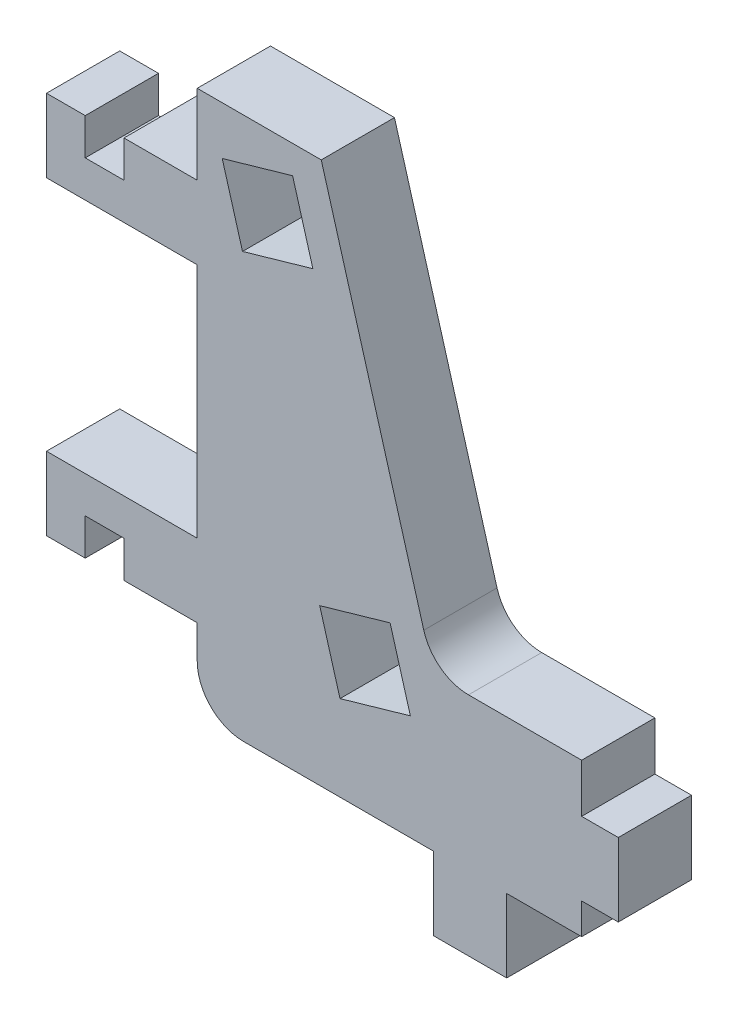
from build123d import *

# Parameters (mm, degrees)
BOSS_EXTRUDE1_DEPTH = 6
FILLET1_R           = 3.81
CUT_EXTRUDE1_DEPTH  = 57.584242648


with BuildPart() as part:
    # Sketch1 → Boss-Extrude1 (new body)
    with BuildSketch(Plane.XY):
        Polygon((-12.35, 31.925), (0, 31.925), (0, 37.925), (-6, 37.925), (-6, 34.925), (-9.175, 34.925), (-9.175, 37.925), (-12.35, 37.925), align=None)
        Polygon((19.3548, 12.525), (31.496, 12.525), (31.496, 8.54), (34.496, 8.54), (34.496, 2.54), (31.496, 2.54), (31.496, 0), (25.3548, 0), (25.3548, -6), (19.3548, -6), (19.3548, 0), (0, 0), (0, 44.45), (10.16, 44.45), align=None)
        Polygon((-6, 6.525), (0, 6.525), (0, 12.525), (-12.35, 12.525), (-12.35, 6.525), (-9.175, 6.525), (-9.175, 9.525), (-6, 9.525), align=None)
    extrude(amount=BOSS_EXTRUDE1_DEPTH)

    # Fillet1
    fillet1_edges = [part.edges().sort_by_distance(p)[0] for p in [
        (19.3548, 12.525, 3),
        (0, 0, 3),
    ]]
    fillet(fillet1_edges, radius=FILLET1_R)

    # Sketch3 → Cut-Extrude1 (cut, through all)
    with BuildSketch(Plane.XY.offset(6)):
        Polygon((3.708914399, 34.727201635), (9.47454486, 36.387775447), (7.813971047, 42.153405908), (2.048340586, 40.492832096), align=None)
        Polygon((15.801331085, 14.42072339), (17.461904898, 8.655092929), (11.696274437, 6.994519117), (10.035700624, 12.760149578), align=None)
    extrude(amount=-CUT_EXTRUDE1_DEPTH, mode=Mode.SUBTRACT)


solid = part.part
